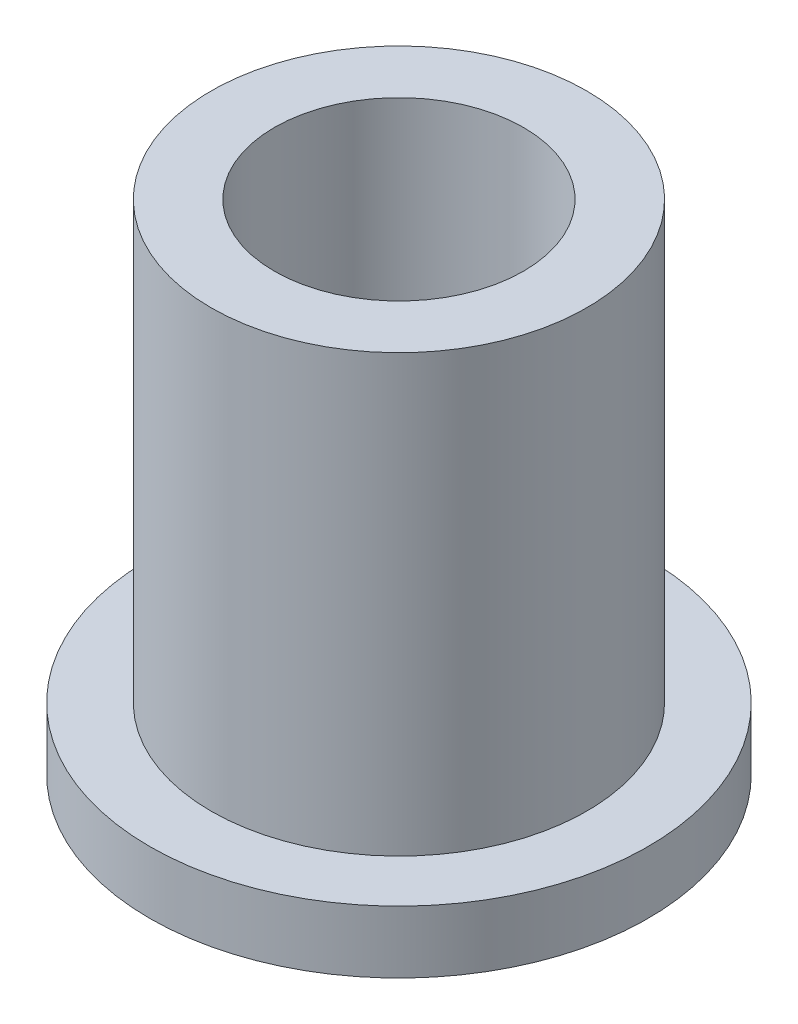
from build123d import *

# Parameters (mm, degrees)
SKETCH2_R           = 4.7879
SKETCH2_R_2         = 3.175
BOSS_EXTRUDE1_DEPTH = 12.7
SKETCH3_R           = 6.35
SKETCH3_R_2         = 4.7879
BOSS_EXTRUDE2_DEPTH = 1.5875


with BuildPart() as part:
    # Sketch2 → Boss-Extrude1 (new body)
    with BuildSketch(Plane(origin=(0, 0, 0), x_dir=(1, 0, 0), z_dir=(0, 1, 0))):
        with Locations(Location((0, 0, 0), (0, 0, 270))):
            Circle(SKETCH2_R)
        with Locations(Location((0, 0, 0), (0, 0, 270))):
            Circle(SKETCH2_R_2, mode=Mode.SUBTRACT)
    extrude(amount=BOSS_EXTRUDE1_DEPTH)

    # Sketch3 → Boss-Extrude2 (add)
    with BuildSketch(Plane(origin=(0, 0, 0), x_dir=(1, 0, 0), z_dir=(0, 1, 0))):
        with Locations(Location((0, 0, 0), (0, 0, 270))):
            Circle(SKETCH3_R)
        with Locations(Location((0, 0, 0), (0, 0, 270))):
            Circle(SKETCH3_R_2, mode=Mode.SUBTRACT)
    extrude(amount=BOSS_EXTRUDE2_DEPTH)


solid = part.part
